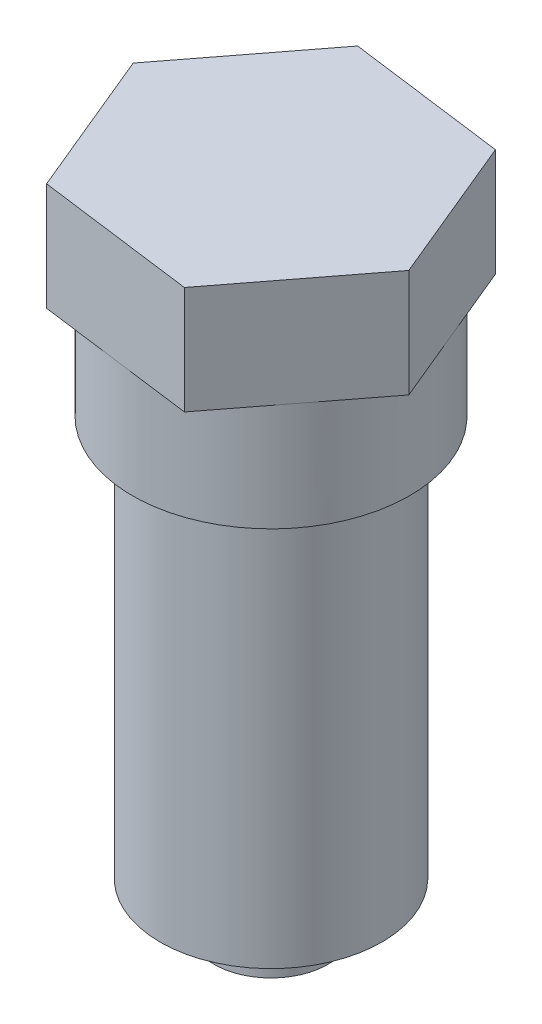
from build123d import *

# Parameters (mm, degrees)
EXTRUDE_1_DEPTH = 7
SKETCH_2_R      = 9
EXTRUDE_2_DEPTH = 7
SKETCH_3_R      = 7.2
EXTRUDE_3_DEPTH = 26
SKETCH_4_R      = 3.7
EXTRUDE_4_DEPTH = 3


with BuildPart() as part:
    # 草图1 → 凸台-拉伸1 (new body)
    with BuildSketch(Plane(origin=(0, 0, 0), x_dir=(1, 0, 0), z_dir=(0, 1, 0))):
        Polygon((6.325906751, 8.245174576), (-3.977577266, 9.600983236), (-10.303484016, 1.35580866), (-6.325906751, -8.245174576), (3.977577266, -9.600983236), (10.303484016, -1.35580866), align=None)
    extrude(amount=EXTRUDE_1_DEPTH)

    # 草图2 → 凸台-拉伸2 (add)
    with BuildSketch(Plane.XZ):
        with Locations(Location((0, 0, 0), (0, 0, 97.49633363))):
            Circle(SKETCH_2_R)
    extrude(amount=EXTRUDE_2_DEPTH)

    # 草图3 → 凸台-拉伸3 (add)
    with BuildSketch(Plane.XZ.offset(7)):
        with Locations(Location((0, 0, 0), (0, 0, 90))):
            Circle(SKETCH_3_R)
    extrude(amount=EXTRUDE_3_DEPTH)

    # 草图4 → 凸台-拉伸4 (add)
    with BuildSketch(Plane.XZ.offset(33)):
        with Locations(Location((0, 0, 0), (0, 0, 270))):
            Circle(SKETCH_4_R)
    extrude(amount=EXTRUDE_4_DEPTH)


solid = part.part
